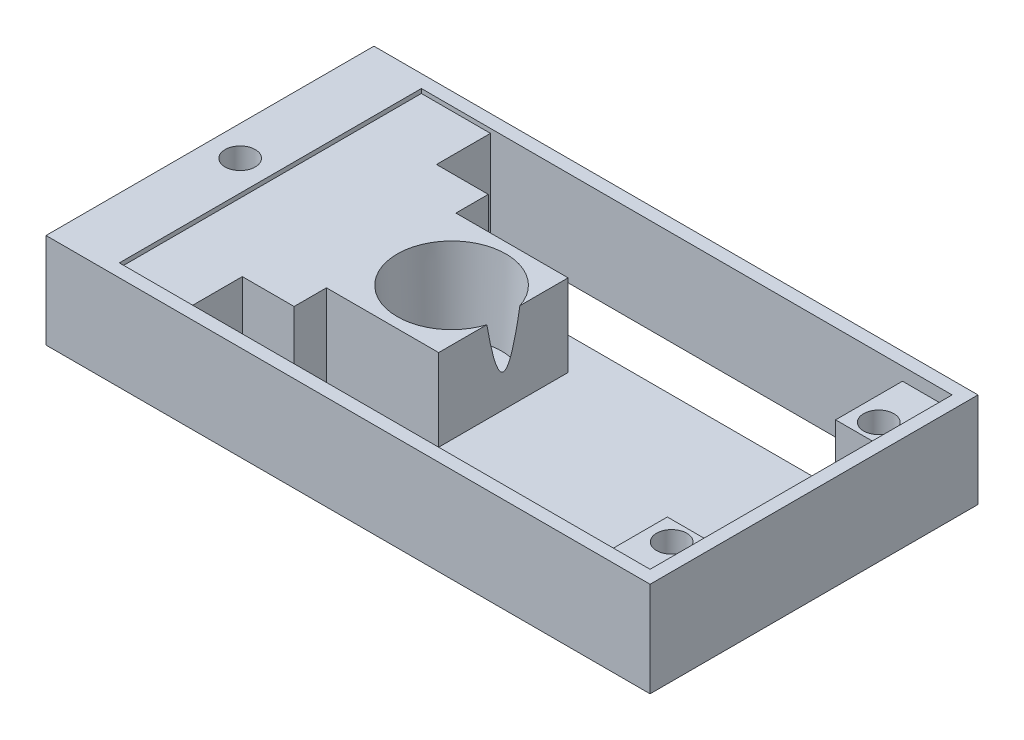
from build123d import *

# Parameters (mm, degrees)
SKETCH2_W               = 70
SKETCH2_H               = 38
SKETCH2_W_2             = 61.5
SKETCH2_H_2             = 35
SKETCH2_R               = 1.75
BOSS_EXTRUDE1_DEPTH     = 1
SKETCH2_3_W             = 70
SKETCH2_3_H             = 38
SKETCH2_3_W_2           = 61.5
SKETCH2_3_H_2           = 35
BOSS_EXTRUDE2_DEPTH     = 10
BOSS_EXTRUDE3_START     = 8.5
SKETCH2_4_R             = 1.75
BOSS_EXTRUDE3_DEPTH     = 8.5
CUT_EXTRUDE1_DEPTH      = 42.31585652
CUT_EXTRUDE1_DEPTH_BACK = 42.31585652
SKETCH3_R               = 1.75
BOSS_EXTRUDE4_DEPTH     = 10.5
SKETCH5_R               = 2.5
CUT_EXTRUDE2_DEPTH      = 1
SKETCH5_3_R             = 5.8
CUT_EXTRUDE3_DEPTH      = 42.060930335
CUT_EXTRUDE3_DRAFT      = -3


with BuildPart() as part:
    # Sketch2 → Boss-Extrude1 (new body)
    # profile 1 of 4: a face of its own
    with BuildSketch(Plane(origin=(0, 0, 0), x_dir=(1, 0, 0), z_dir=(0, 1, 0))):
        Rectangle(SKETCH2_W, SKETCH2_H)
        with Locations((2.75, 0)):
            Rectangle(SKETCH2_W_2, SKETCH2_H_2, mode=Mode.SUBTRACT)
    # profile 2 of 4: a face of its own
    with BuildSketch(Plane(origin=(0, 0, 0), x_dir=(1, 0, 0), z_dir=(0, 1, 0))):
        Polygon((27.75, 11.25), (-28, 11.25), (-28, -11.25), (27.75, -11.25), (27.75, -9.75), (33.5, -9.75), (33.5, 9.75), (27.75, 9.75), align=None)
    # profile 3 of 4: a face of its own
    with BuildSketch(Plane(origin=(0, 0, 0), x_dir=(1, 0, 0), z_dir=(0, 1, 0))):
        Polygon((33.5, 17.5), (27.75, 17.5), (27.75, 11.25), (27.75, 9.75), (33.5, 9.75), align=None)
        with Locations(Location((30.5, 12, 0), (0, 0, 270))):
            Circle(SKETCH2_R, mode=Mode.SUBTRACT)
    # profile 4 of 4: a face of its own
    with BuildSketch(Plane(origin=(0, 0, 0), x_dir=(1, 0, 0), z_dir=(0, 1, 0))):
        Polygon((27.75, -9.75), (27.75, -11.25), (27.75, -17.5), (33.5, -17.5), (33.5, -9.75), align=None)
        with Locations(Location((30.5, -12, 0), (0, 0, 270))):
            Circle(SKETCH2_R, mode=Mode.SUBTRACT)
    extrude(amount=-BOSS_EXTRUDE1_DEPTH)

    # Sketch2<3> → Boss-Extrude2 (add)
    with BuildSketch(Plane(origin=(0, 0, 0), x_dir=(1, 0, 0), z_dir=(0, 1, 0))):
        Rectangle(SKETCH2_3_W, SKETCH2_3_H)
        with Locations((2.75, 0)):
            Rectangle(SKETCH2_3_W_2, SKETCH2_3_H_2, mode=Mode.SUBTRACT)
    extrude(amount=BOSS_EXTRUDE2_DEPTH)

    # Sketch2<4> → Boss-Extrude3 (add)
    # profile 1 of 2: a face of its own
    with BuildSketch(Plane(origin=(0, 0, 0), x_dir=(1, 0, 0), z_dir=(0, 1, 0)).offset(BOSS_EXTRUDE3_START)):
        Polygon((33.5, 17.5), (27.75, 17.5), (27.75, 11.25), (27.75, 9.75), (33.5, 9.75), align=None)
        with Locations(Location((30.5, 12, 0), (0, 0, 270))):
            Circle(SKETCH2_4_R, mode=Mode.SUBTRACT)
    # profile 2 of 2: a face of its own
    with BuildSketch(Plane(origin=(0, 0, 0), x_dir=(1, 0, 0), z_dir=(0, 1, 0)).offset(BOSS_EXTRUDE3_START)):
        Polygon((27.75, -9.75), (27.75, -11.25), (27.75, -17.5), (33.5, -17.5), (33.5, -9.75), align=None)
        with Locations(Location((30.5, -12, 0), (0, 0, 270))):
            Circle(SKETCH2_4_R, mode=Mode.SUBTRACT)
    extrude(amount=-BOSS_EXTRUDE3_DEPTH)

    # Sketch3 → Cut-Extrude1 (cut, two sides: drawn at the far end of the back side and taken through both)
    with BuildSketch(Plane(origin=(0, 10, 0), x_dir=(1, 0, 0), z_dir=(0, 1, 0)).offset(-CUT_EXTRUDE1_DEPTH_BACK)):
        with Locations(Location((30.5, -12, 0), (0, 0, 270))):
            Circle(SKETCH3_R)
        with Locations(Location((30.5, 12, 0), (0, 0, 270))):
            Circle(SKETCH3_R)
        with Locations(Location((-31.5, 0, 0), (0, 0, 270))):
            Circle(SKETCH3_R)
    extrude(amount=CUT_EXTRUDE1_DEPTH + CUT_EXTRUDE1_DEPTH_BACK, mode=Mode.SUBTRACT)

    # Sketch4 → Boss-Extrude4 (add)
    with BuildSketch(Plane(origin=(0, -1, 0), x_dir=(1, 0, 0), z_dir=(0, 1, 0))):
        Polygon((-28, 17.5), (-20, 17.5), (-20, 11.25), (-14, 11.25), (-14, 7.5), (-1, 7.5), (-1, -7.5), (-14, -7.5), (-14, -11.25), (-20, -11.25), (-20, -17.5), (-28, -17.5), align=None)
    extrude(amount=BOSS_EXTRUDE4_DEPTH)

    # Sketch5 → Cut-Extrude2 (cut)
    with BuildSketch(Plane(origin=(0, 0, 0), x_dir=(1, 0, 0), z_dir=(0, 1, 0))):
        with Locations(Location((-7, 0, 0), (0, 0, 270))):
            Circle(SKETCH5_R)
    extrude(amount=-CUT_EXTRUDE2_DEPTH, mode=Mode.SUBTRACT)


with BuildPart() as cut_extrude3_tool:
    # Sketch5<3> → Cut-Extrude3 (with draft: the straight prism first)
    with BuildSketch(Plane(origin=(0, 0, 0), x_dir=(1, 0, 0), z_dir=(0, 1, 0))):
        with Locations((-7, 0)):
            Circle(SKETCH5_3_R)
    extrude(amount=CUT_EXTRUDE3_DEPTH)
    # Cut-Extrude3: the draft: its side faces are tilted about the plane it starts from
    cut_extrude3_sides = [cut_extrude3_tool.faces().sort_by_distance(p)[0] for p in [
        (-12.8, 21.030465168, 0),
    ]]
    draft(cut_extrude3_sides, Plane(origin=(0, 0, 0), x_dir=(1, 0, 0), z_dir=(0, 1, 0)), CUT_EXTRUDE3_DRAFT)


with BuildPart() as part_1:
    add(part.part)

    # Cut-Extrude3: cut by cut_extrude3_tool
    add(cut_extrude3_tool.part, mode=Mode.SUBTRACT)


solid = part_1.part
